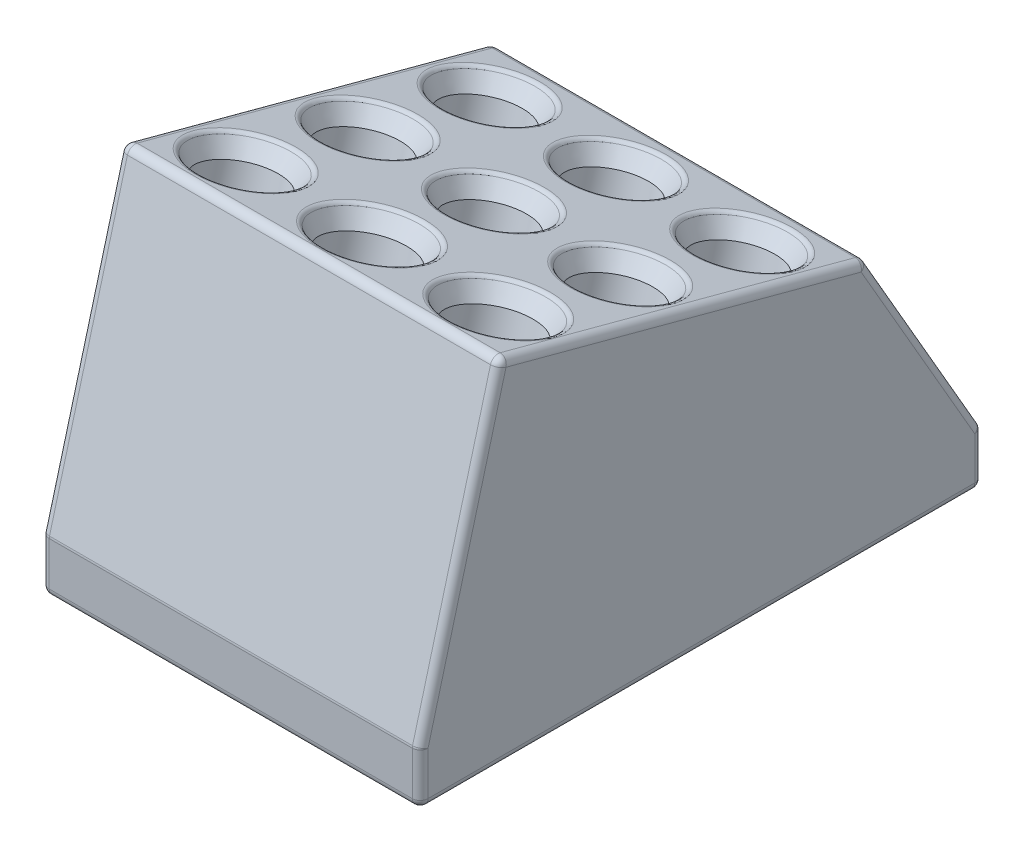
from build123d import *

# Parameters (mm, degrees)
BOSS_EXTRUDE1_DEPTH = 72
SKETCH4_R           = 7.75
SKETCH4_R_2         = 7.35
CUT_EXTRUDE1_DEPTH  = 45
CHAMFER1_SIZE       = 2
CHAMFER1_SIZE2      = 3.464101615
FILLET1_R           = 1.5
FILLET2_R           = 1.5
FILLET3_R           = 1


with BuildPart() as part:
    # Sketch1 → Boss-Extrude1 (new body)
    with BuildSketch(Plane(origin=(0, 0, 0), x_dir=(0, 0, -1), z_dir=(1, 0, 0))):
        Polygon((0, 0), (0, 10), (15.254685828, 66.931262562), (84.80134532, 48.296291314), (106.91171942, 10), (106.91171942, 0), align=None)
    extrude(amount=BOSS_EXTRUDE1_DEPTH)

    # Sketch4 → Cut-Extrude1 (cut)
    with BuildSketch(Plane(origin=(0, 66.261389581, -17.754685828), x_dir=(1, 0, 0), z_dir=(0, 0.9659258262890681, -0.25881904510252135))):
        with Locations(Location((60, 9.411809549, 0), (0, 0, 270))):
            Circle(SKETCH4_R)
        with Locations(Location((36, 9.411809549, 0), (0, 0, 270))):
            Circle(SKETCH4_R)
        with Locations(Location((12, 9.411809549, 0), (0, 0, 270))):
            Circle(SKETCH4_R_2)
        with Locations(Location((60, 33.411809549, 0), (0, 0, 270))):
            Circle(SKETCH4_R_2)
        with Locations(Location((36, 33.411809549, 0), (0, 0, 270))):
            Circle(SKETCH4_R_2)
        with Locations(Location((12, 33.411809549, 0), (0, 0, 270))):
            Circle(SKETCH4_R_2)
        with Locations(Location((60, 57.411809549, 0), (0, 0, 270))):
            Circle(SKETCH4_R_2)
        with Locations(Location((36, 57.411809549, 0), (0, 0, 270))):
            Circle(SKETCH4_R_2)
        with Locations(Location((12, 57.411809549, 0), (0, 0, 270))):
            Circle(SKETCH4_R_2)
    extrude(amount=-CUT_EXTRUDE1_DEPTH, mode=Mode.SUBTRACT)

    # Chamfer1
    chamfer1_edges = [part.edges().sort_by_distance(p)[0] for p in [
        (36, 55.711456957, -57.127570397),
        (60, 55.711456957, -57.127570397),
        (12, 61.923114039, -33.945350566),
        (36, 61.819586421, -34.331720897),
        (12, 49.499799874, -80.309790228),
        (36, 49.499799874, -80.309790228),
        (60, 49.499799874, -80.309790228),
        (12, 55.711456957, -57.127570397),
        (60, 61.819586421, -34.331720897),
    ]]
    chamfer1_side = [part.faces().sort_by_distance(p)[0] for p in [
        (36, 66.667724271, -16.238224118),
    ]]
    chamfer(chamfer1_edges, length=CHAMFER1_SIZE, length2=CHAMFER1_SIZE2, reference=chamfer1_side[0])

    # Fillet1
    fillet1_edges = [part.edges().sort_by_distance(p)[0] for p in [
        (36, 12.244794774, -45.480713368),
        (60, 12.244794774, -45.480713368),
        (12, 18.456451856, -22.298493537),
        (36, 18.352924238, -22.684863867),
        (12, 6.033137691, -68.662933198),
        (36, 6.033137691, -68.662933198),
        (60, 6.033137691, -68.662933198),
        (12, 12.244794774, -45.480713368),
        (60, 18.352924238, -22.684863867),
    ]]
    fillet(fillet1_edges, radius=FILLET1_R)

    # Fillet2
    fillet2_edges = [part.edges().sort_by_distance(p)[0] for p in [
        (36, 0, 0),
        (36, 10, 0),
        (36, 66.931262562, -15.254685828),
        (36, 48.296291314, -84.80134532),
        (36, 10, -106.91171942),
        (36, 0, -106.91171942),
        (72, 29.148145657, -95.85653237),
        (72, 57.613776938, -50.028015574),
        (72, 38.465631281, -7.627342914),
        (72, 5, 0),
        (72, 0, -53.45585971),
        (0, 5, 0),
        (0, 38.465631281, -7.627342914),
        (0, 57.613776938, -50.028015574),
        (0, 29.148145657, -95.85653237),
        (0, 5, -106.91171942),
        (0, 0, -53.45585971),
        (72, 5, -106.91171942),
    ]]
    fillet(fillet2_edges, radius=FILLET2_R)

    # Fillet3
    fillet3_edges = [part.edges().sort_by_distance(p)[0] for p in [
        (60, 61.301948331, -36.263572549),
        (36, 61.301948331, -36.263572549),
        (12, 61.405475949, -35.877202219),
        (12, 55.193818866, -59.05942205),
        (36, 55.193818866, -59.05942205),
        (60, 55.193818866, -59.05942205),
        (60, 48.982161784, -82.241641881),
        (36, 48.982161784, -82.241641881),
        (12, 48.982161784, -82.241641881),
    ]]
    fillet(fillet3_edges, radius=FILLET3_R)


solid = part.part
